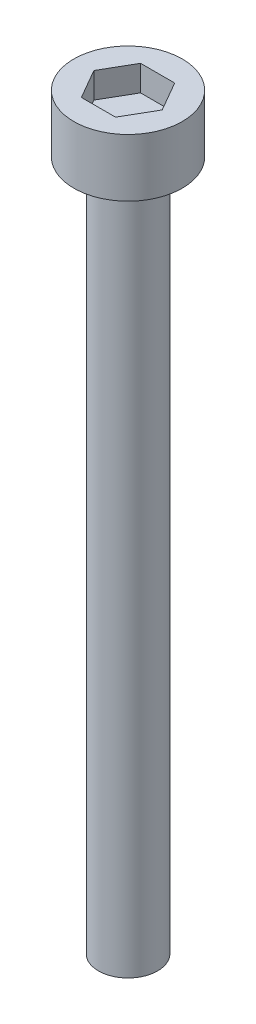
from build123d import *

# Parameters (mm, degrees)
SKETCH_1_R      = 2.75
EXTRUDE_1_DEPTH = 2.93
EXTRUDE_2_DEPTH = 1.63
SKETCH_2_R      = 1.5
EXTRUDE_3_DEPTH = 35


with BuildPart() as part:
    # 草图1 → 凸台-拉伸1 (new body)
    with BuildSketch(Plane(origin=(0, 0, 0), x_dir=(1, 0, 0), z_dir=(0, 1, 0))):
        with Locations(Location((0, 0, 0), (0, 0, 90))):
            Circle(SKETCH_1_R)
        Polygon((0.866025404, 1.5), (-0.866025404, 1.5), (-1.732050808, 0), (-0.866025404, -1.5), (0.866025404, -1.5), (1.732050808, 0), align=None, mode=Mode.SUBTRACT)
    extrude(amount=EXTRUDE_1_DEPTH)

    # 草图1<2> → 凸台-拉伸2 (add)
    with BuildSketch(Plane(origin=(0, 0, 0), x_dir=(1, 0, 0), z_dir=(0, 1, 0))):
        Polygon((0.866025404, 1.5), (-0.866025404, 1.5), (-1.732050808, 0), (-0.866025404, -1.5), (0.866025404, -1.5), (1.732050808, 0), align=None)
    extrude(amount=EXTRUDE_2_DEPTH)

    # 草图2 → 凸台-拉伸3 (add)
    with BuildSketch(Plane.XZ):
        with Locations(Location((0, 0, 0), (0, 0, 90))):
            Circle(SKETCH_2_R)
    extrude(amount=EXTRUDE_3_DEPTH)


solid = part.part
